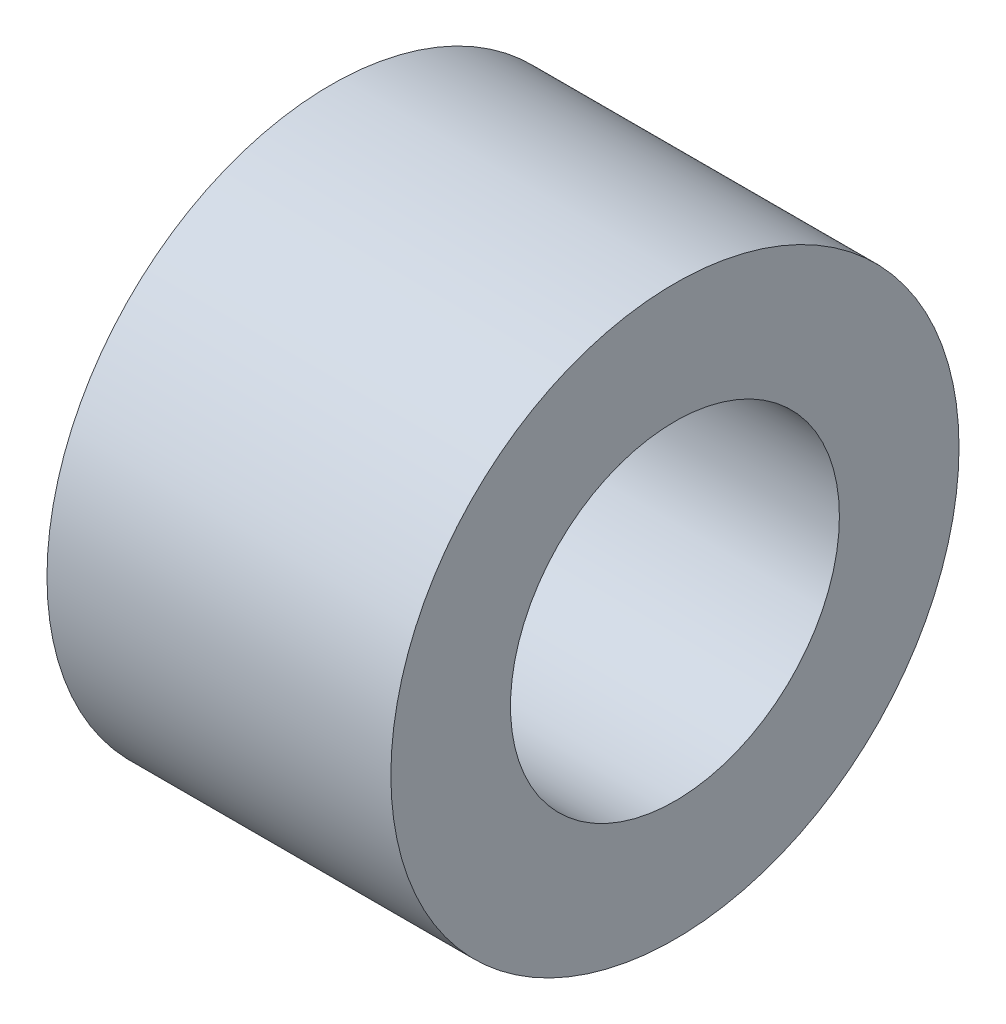
from build123d import *

# Parameters (mm, degrees)
CROQUIS1_R              = 4.75
CROQUIS1_R_2            = 2.75
SALIENTE_EXTRUIR1_DEPTH = 5.75


with BuildPart() as part:
    # Croquis1 → Saliente-Extruir1 (new body)
    with BuildSketch(Plane(origin=(0, 0, 0), x_dir=(0, 0, -1), z_dir=(1, 0, 0))):
        Circle(CROQUIS1_R)
        Circle(CROQUIS1_R_2, mode=Mode.SUBTRACT)
    extrude(amount=SALIENTE_EXTRUIR1_DEPTH)


solid = part.part
